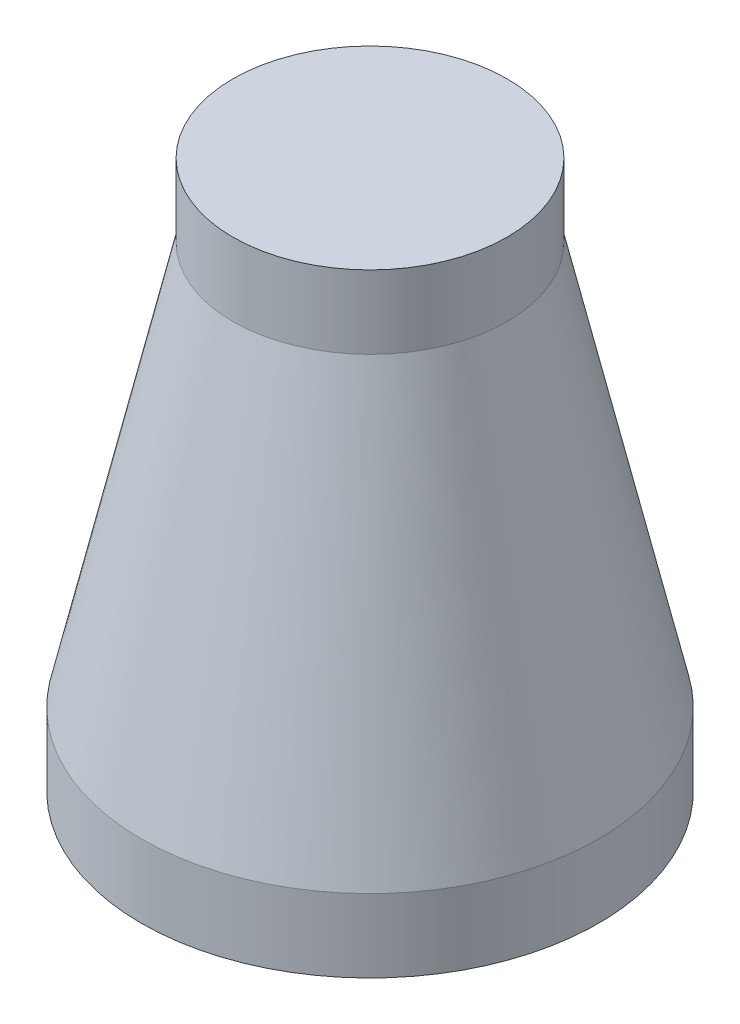
from build123d import *


with BuildPart() as part:
    # 草图1 → 旋转1 (revolve)
    with BuildSketch(Plane.XY, mode=Mode.PRIVATE) as revolve_1_sk:
        Polygon((0, 0), (0, 60), (15, 60), (15, 52), (25, 8), (25, 0), align=None)
    revolve(revolve_1_sk.sketch.rotate(Axis((0, 0, 0), (0, 1, 0)), 90), axis=Axis((0, 0, 0), (0, 1, 0)))


solid = part.part
